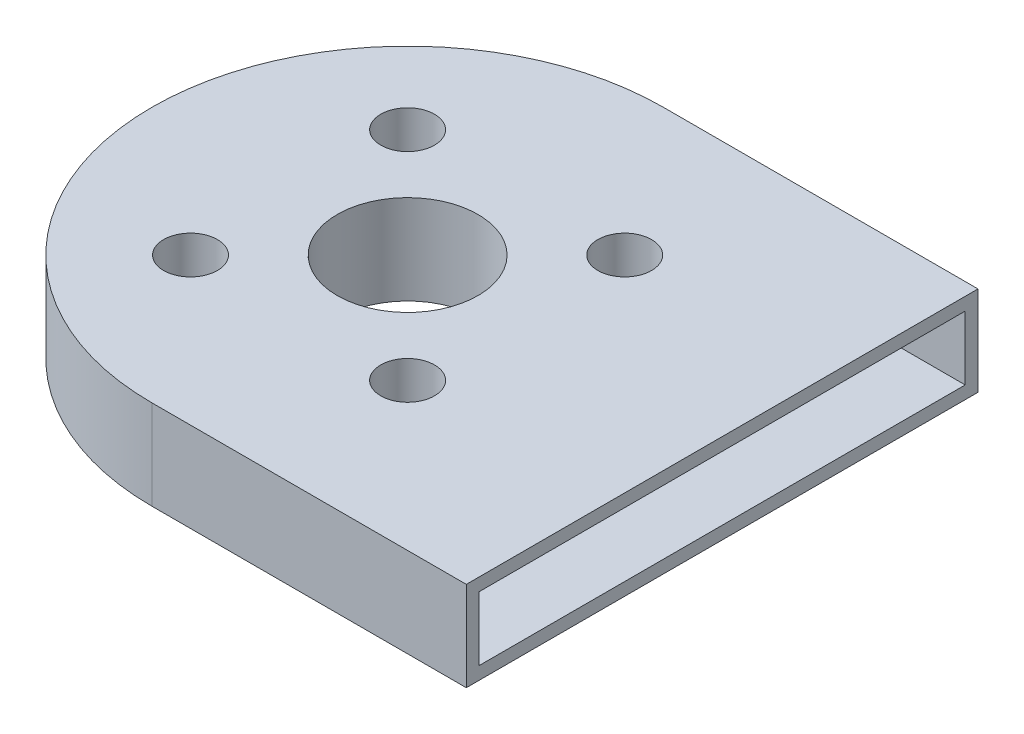
from build123d import *

# Parameters (mm, degrees)
SKETCH1_R           = 10
SKETCH1_R_2         = 1.05
SKETCH1_R_3         = 2.75
BOSS_EXTRUDE1_DEPTH = 3.5
SKETCH8_R           = 1.05
CUT_EXTRUDE2_DEPTH  = 10
BOSS_EXTRUDE5_DEPTH = 3.5
SHELL2_T            = -0.5


with BuildPart() as part:
    # Sketch1 → Boss-Extrude1 (new body)
    with BuildSketch(Plane(origin=(0, 0, 0), x_dir=(1, 0, 0), z_dir=(0, 1, 0))):
        with Locations(Location((0, 0, 0), (0, 0, 270))):
            Circle(SKETCH1_R)
        with Locations(Location((-4.24264069, 4.24264069, 0), (0, 0, 270))):
            Circle(SKETCH1_R_2, mode=Mode.SUBTRACT)
        with Locations(Location((0, 0, 0), (0, 0, 270))):
            Circle(SKETCH1_R_3, mode=Mode.SUBTRACT)
    extrude(amount=BOSS_EXTRUDE1_DEPTH)

    # Sketch8 → Cut-Extrude2 (cut)
    with BuildSketch(Plane(origin=(0, 3.5, 0), x_dir=(1, 0, 0), z_dir=(0, 1, 0))):
        with Locations(Location((-4.24264069, -4.24264069, 0), (0, 0, 270))):
            Circle(SKETCH8_R)
        with Locations(Location((4.24264069, 4.24264069, 0), (0, 0, 270))):
            Circle(SKETCH8_R)
        with Locations(Location((4.24264069, -4.24264069, 0), (0, 0, 270))):
            Circle(SKETCH8_R)
    extrude(amount=-CUT_EXTRUDE2_DEPTH, mode=Mode.SUBTRACT)

    # Sketch11 → Boss-Extrude5 (add)
    with BuildSketch(Plane.XZ):
        with BuildLine():
            Line((12.293904652, 10), (0, 10))
            ThreePointArc((0, 10), (7.071067812, 7.071067812), (10, 0))
            ThreePointArc((10, 0), (7.071067812, -7.071067812), (0, -10))
            Line((0, -10), (12.293904652, -10))
            Line((12.293904652, -10), (12.293904652, 10))
        make_face()
    extrude(amount=-BOSS_EXTRUDE5_DEPTH)

    # Shell2
    shell2_openings = [part.faces().sort_by_distance(p)[0] for p in [
        (12.293904652, 1.75, 0),
    ]]
    offset(amount=SHELL2_T, openings=shell2_openings, kind=Kind.INTERSECTION)


solid = part.part
